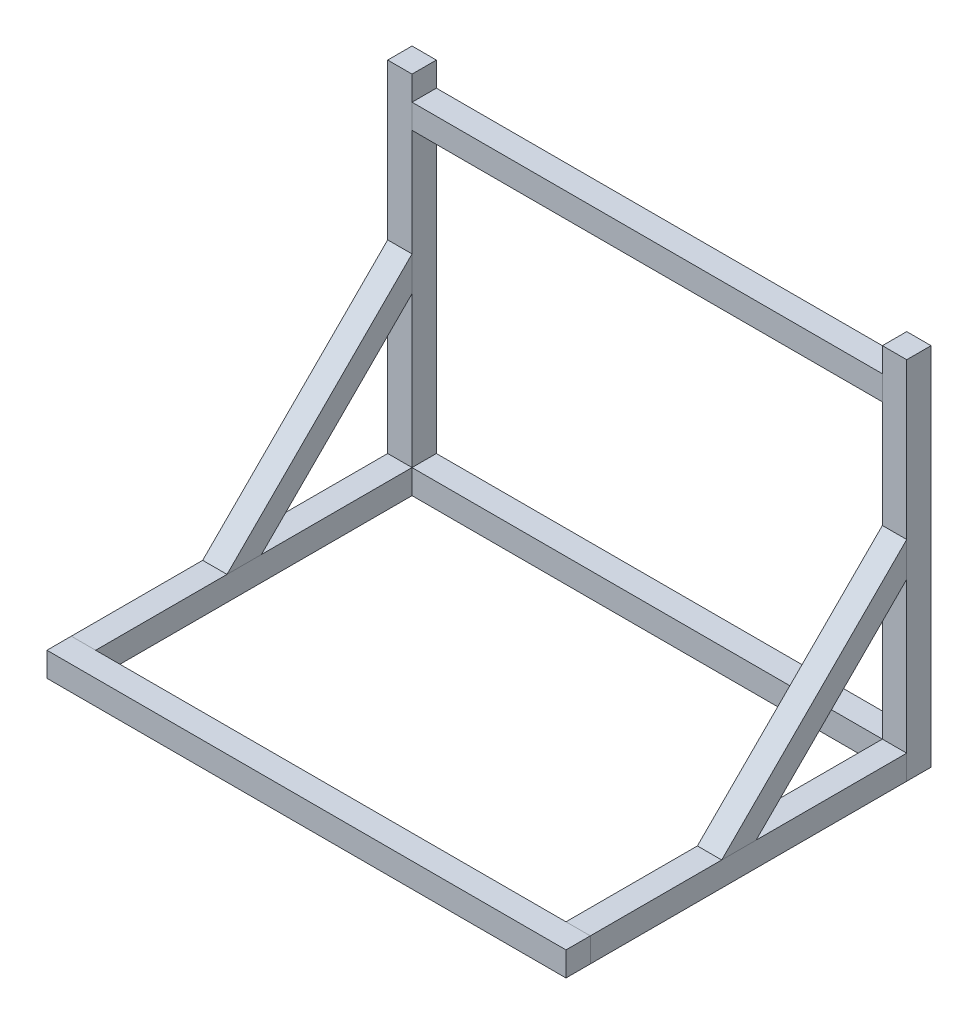
from build123d import *

# Parameters (mm, degrees)
SKETCH_2_W        = 40
SKETCH_2_H        = 40
EXTRUDE_1_DEPTH   = 520
EXTRUDE_1_2_DEPTH = 520
SKETCH_8_W        = 40
SKETCH_8_H        = 40
EXTRUDE_4_DEPTH   = 600
EXTRUDE_4_2_DEPTH = 600
SKETCH_9_W        = 40
SKETCH_9_H        = 40
EXTRUDE_6_DEPTH   = 773
EXTRUDE_7_DEPTH   = 40
EXTRUDE_8_DEPTH   = 40
SKETCH_16_W       = 40
SKETCH_16_H       = 40
EXTRUDE_9_DEPTH   = 853
SKETCH_17_W       = 40
SKETCH_17_H       = 40
EXTRUDE_10_DEPTH  = 773


with BuildPart() as part:
    # ｽｹｯﾁ2 → ﾎﾞｽ - 押し出し1 (new body)
    with BuildSketch(Plane.XY):
        with Locations((-164.32000567, -16.306275718)):
            Rectangle(SKETCH_2_W, SKETCH_2_H)
    extrude(amount=EXTRUDE_1_DEPTH)


with BuildPart() as body_2:
    # ｽｹｯﾁ2 → Extrude 1 2 (new body)
    with BuildSketch(Plane.XY):
        with Locations((648.67999433, -16.306275718)):
            Rectangle(SKETCH_2_W, SKETCH_2_H)
    extrude(amount=EXTRUDE_1_2_DEPTH)


with BuildPart() as body_3:
    # ｽｹｯﾁ8 → ﾎﾞｽ - 押し出し4 (new body)
    with BuildSketch(Plane.XZ.offset(36.306275718)):
        with Locations((-164.32000567, -20)):
            Rectangle(SKETCH_8_W, SKETCH_8_H)
    extrude(amount=-EXTRUDE_4_DEPTH)


with BuildPart() as body_4:
    # ｽｹｯﾁ8 → Extrude 4 2 (new body)
    with BuildSketch(Plane.XZ.offset(36.306275718)):
        with Locations((648.67999433, -20)):
            Rectangle(SKETCH_8_W, SKETCH_8_H)
    extrude(amount=-EXTRUDE_4_2_DEPTH)


with BuildPart() as body_5:
    # ｽｹｯﾁ9 → ﾎﾞｽ - 押し出し6 (new body)
    with BuildSketch(Plane.ZY.offset(-628.67999433)):
        with Locations((-20, -16.306275718)):
            Rectangle(SKETCH_9_W, SKETCH_9_H)
    extrude(amount=EXTRUDE_6_DEPTH)


with BuildPart() as body_6:
    # ｽｹｯﾁ13 → ﾎﾞｽ - 押し出し7 (new body)
    with BuildSketch(Plane(origin=(668.67999433, 0, 0), x_dir=(0, 0, -1), z_dir=(1, 0, 0))):
        Polygon((-304.05591591, 3.693724282), (0, 307.749640192), (0, 251.181097697), (-247.487373415, 3.693724282), align=None)
    extrude(amount=-EXTRUDE_7_DEPTH)


with BuildPart() as body_7:
    # ｽｹｯﾁ14 → ﾎﾞｽ - 押し出し8 (new body)
    with BuildSketch(Plane.ZY.offset(184.32000567)):
        Polygon((0, 307.749640192), (304.05591591, 3.693724282), (247.487373415, 3.693724282), (0, 251.181097697), align=None)
    extrude(amount=-EXTRUDE_8_DEPTH)


with BuildPart() as body_8:
    # ｽｹｯﾁ16 → ﾎﾞｽ - 押し出し9 (new body)
    with BuildSketch(Plane.ZY.offset(184.32000567)):
        with Locations((540, -16.306275718)):
            Rectangle(SKETCH_16_W, SKETCH_16_H)
    extrude(amount=-EXTRUDE_9_DEPTH)


with BuildPart() as body_9:
    # ｽｹｯﾁ17 → ﾎﾞｽ - 押し出し10 (new body)
    with BuildSketch(Plane(origin=(-144.32000567, 0, 0), x_dir=(0, 0, -1), z_dir=(1, 0, 0))):
        with Locations((20, 503.693724282)):
            Rectangle(SKETCH_17_W, SKETCH_17_H)
    extrude(amount=EXTRUDE_10_DEPTH)


solid = Compound([part.part, body_2.part, body_3.part, body_4.part, body_5.part, body_6.part, body_7.part, body_8.part, body_9.part])
